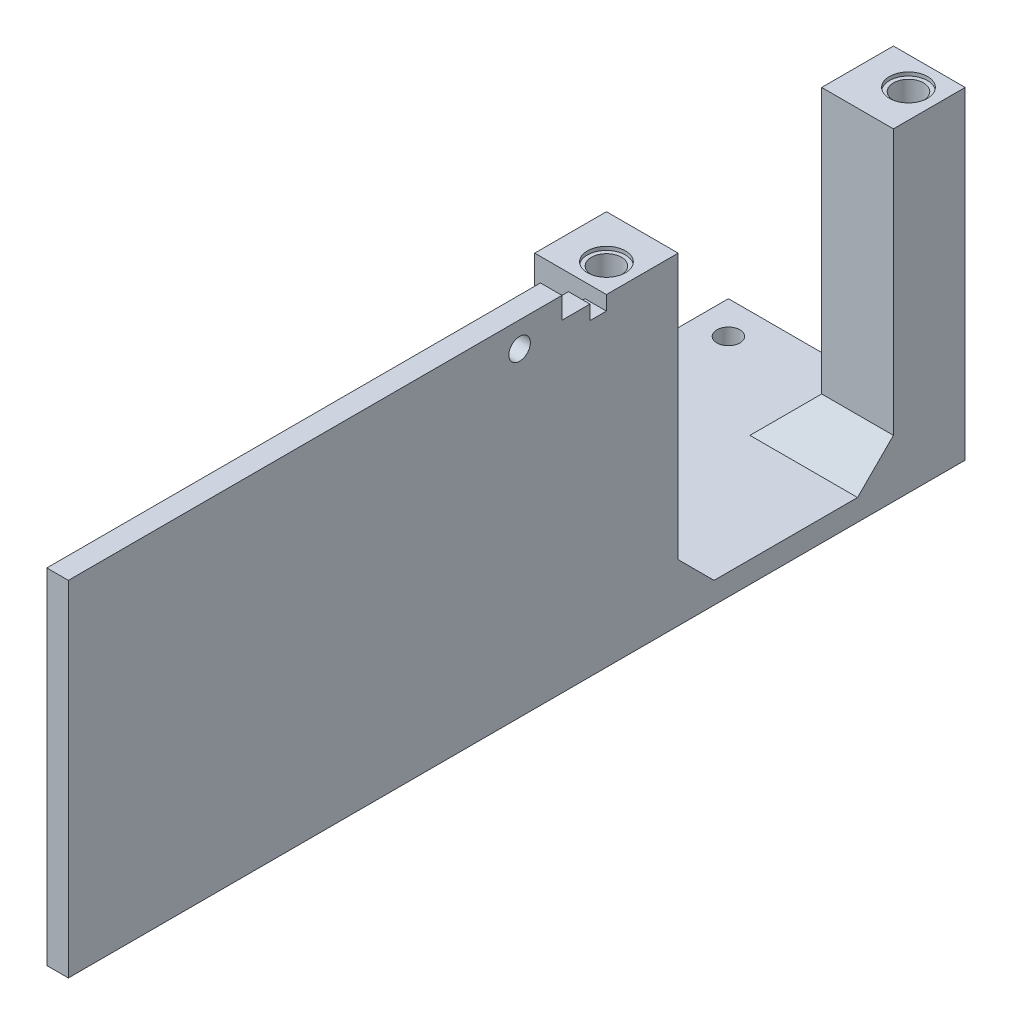
from build123d import *

# Parameters (mm, degrees)
SKETCH1_R           = 1.6
BOSS_EXTRUDE1_DEPTH = 3
SKETCH2_W           = 10
SKETCH2_H           = 10
BOSS_EXTRUDE2_DEPTH = 42
CHAMFER1_SIZE       = 5
SKETCH3_R           = 2.1
CUT_EXTRUDE1_DEPTH  = 52
SKETCH4_R           = 2.65
CUT_EXTRUDE2_DEPTH  = 0.5
SKETCH5_W           = 3
SKETCH5_H           = 43
BOSS_EXTRUDE3_DEPTH = 75
SKETCH6_W           = 3
SKETCH6_H           = 3.9
BOSS_EXTRUDE4_DEPTH = 2
SKETCH7_W           = 3
SKETCH7_H           = 68.8
BOSS_EXTRUDE5_DEPTH = 5
SKETCH8_R           = 1.5
CUT_EXTRUDE3_DEPTH  = 5


with BuildPart() as part:
    # Sketch1 → Boss-Extrude1 (new body)
    with BuildSketch(Plane(origin=(0, 0, 0), x_dir=(1, 0, 0), z_dir=(0, 1, 0))):
        Polygon((-6.512396694, 9.685950413), (1.487603306, 9.685950413), (26.487603306, 9.685950413), (26.487603306, -40.314049587), (1.487603306, -40.314049587), (-6.512396694, -40.314049587), align=None)
        with Locations(Location((-1.962396694, -35.764049587, 0), (0, 0, 270))):
            Circle(SKETCH1_R, mode=Mode.SUBTRACT)
        with Locations(Location((-1.962396694, 5.135950413, 0), (0, 0, 270))):
            Circle(SKETCH1_R, mode=Mode.SUBTRACT)
    extrude(amount=BOSS_EXTRUDE1_DEPTH)

    # Sketch2 → Boss-Extrude2 (add)
    with BuildSketch(Plane(origin=(0, 3, 0), x_dir=(1, 0, 0), z_dir=(0, 1, 0))):
        with Locations((21.487603306, -35.314049587)):
            Rectangle(SKETCH2_W, SKETCH2_H)
        with Locations((21.487603306, 4.685950413)):
            Rectangle(SKETCH2_W, SKETCH2_H)
    extrude(amount=BOSS_EXTRUDE2_DEPTH)

    # Chamfer1
    chamfer1_edges = [part.edges().sort_by_distance(p)[0] for p in [
        (21.487603306, 3, 30.314049587),
        (16.487603306, 3, 35.314049587),
        (16.487603306, 3, -4.685950413),
        (21.487603306, 3, 0.314049587),
    ]]
    chamfer(chamfer1_edges, length=CHAMFER1_SIZE)

    # Sketch3 → Cut-Extrude1 (cut)
    with BuildSketch(Plane(origin=(0, 45, 0), x_dir=(1, 0, 0), z_dir=(0, 1, 0))):
        with Locations(Location((22.537603306, -36.364049587, 0), (0, 0, 270))):
            Circle(SKETCH3_R)
        with Locations(Location((22.537603306, 5.735950413, 0), (0, 0, 270))):
            Circle(SKETCH3_R)
    extrude(amount=-CUT_EXTRUDE1_DEPTH, mode=Mode.SUBTRACT)

    # Sketch4 → Cut-Extrude2 (cut)
    with BuildSketch(Plane(origin=(0, 45, 0), x_dir=(1, 0, 0), z_dir=(0, 1, 0))):
        with Locations(Location((22.537603306, -36.364049587, 0), (0, 0, 270))):
            Circle(SKETCH4_R)
        with Locations(Location((22.537603306, 5.735950413, 0), (0, 0, 270))):
            Circle(SKETCH4_R)
    cut_extrude2 = extrude(amount=-CUT_EXTRUDE2_DEPTH, mode=Mode.SUBTRACT)

    # Mirror1: Cut-Extrude2 across plane
    add(cut_extrude2.mirror(Plane(origin=(0, 22.5, 0), x_dir=(0, 0, 1), z_dir=(0, -1, 0))), mode=Mode.SUBTRACT)

    # Sketch5 → Boss-Extrude3 (add)
    with BuildSketch(Plane.XY.offset(40.314049587)):
        with Locations((24.987603306, 21.5)):
            Rectangle(SKETCH5_W, SKETCH5_H)
    extrude(amount=BOSS_EXTRUDE3_DEPTH)

    # Sketch6 → Boss-Extrude4 (add)
    with BuildSketch(Plane(origin=(0, 43, 0), x_dir=(1, 0, 0), z_dir=(0, 1, 0))):
        with Locations((24.987603306, -44.564049587)):
            Rectangle(SKETCH6_W, SKETCH6_H)
    extrude(amount=BOSS_EXTRUDE4_DEPTH)

    # Sketch7 → Boss-Extrude5 (add)
    with BuildSketch(Plane(origin=(0, 43, 0), x_dir=(1, 0, 0), z_dir=(0, 1, 0))):
        with Locations((24.987603306, -80.914049587)):
            Rectangle(SKETCH7_W, SKETCH7_H)
    extrude(amount=BOSS_EXTRUDE5_DEPTH)

    # Sketch8 → Cut-Extrude3 (cut)
    with BuildSketch(Plane.ZY.offset(-23.487603306)):
        with Locations(Location((52.414049587, 44.5, 0), (0, 0, 270))):
            Circle(SKETCH8_R)
    extrude(amount=-CUT_EXTRUDE3_DEPTH, mode=Mode.SUBTRACT)


solid = part.part
